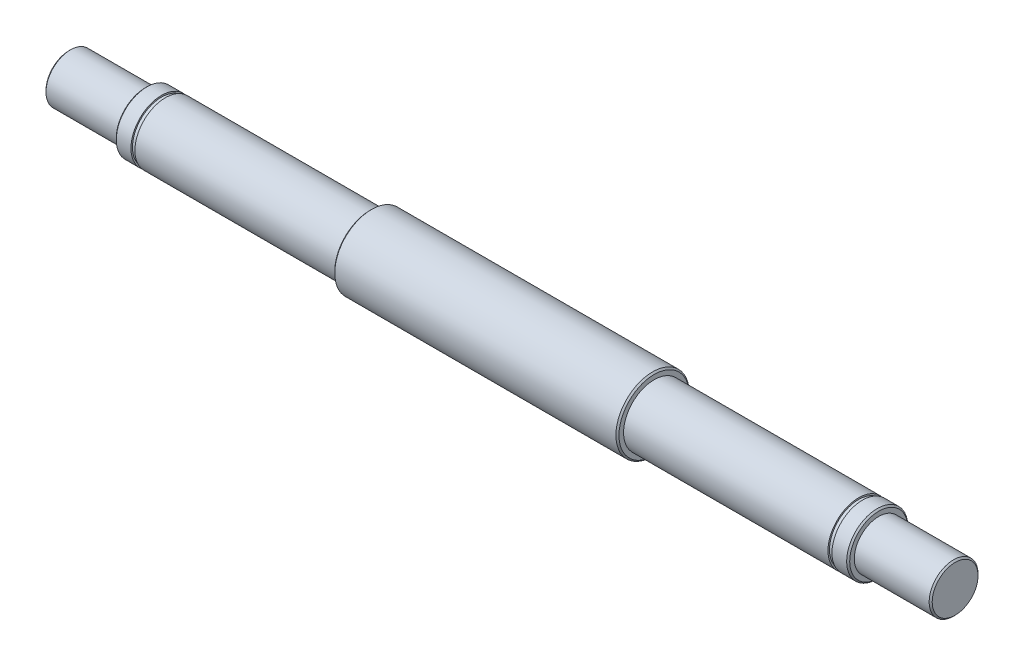
from build123d import *

# Parameters (mm, degrees)
CHAMFER1_SIZE = 0.5


with BuildPart() as part:
    # Sketch1 → Revolve1 (revolve)
    with BuildSketch(Plane(origin=(0, 0, 0), x_dir=(1, 0, 0), z_dir=(0, 1, 0)), mode=Mode.PRIVATE) as revolve1_sk:
        Polygon((-145, 0), (-145, 8), (-120, 8), (-120, 10), (-114.7, 10), (-114.7, 9.5), (-113.4, 9.5), (-113.4, 10), (-46.5, 10), (-46.5, 12), (46.5, 12), (46.5, 10), (113.4, 10), (113.4, 9.5), (114.7, 9.5), (114.7, 10), (120, 10), (120, 8), (145, 8), (145, 0), align=None)
    revolve(revolve1_sk.sketch.rotate(Axis((-145, 0, 0), (1, 0, 0)), 180), axis=Axis((-145, 0, 0), (1, 0, 0)))

    # Chamfer1
    chamfer1_edges = [part.edges().sort_by_distance(p)[0] for p in [
        (-145, 0, -8),
        (-120, 0, -10),
        (-46.5, 0, -12),
        (46.5, 0, -12),
        (120, 0, -10),
        (145, 0, -8),
    ]]
    chamfer(chamfer1_edges, length=CHAMFER1_SIZE)


solid = part.part
